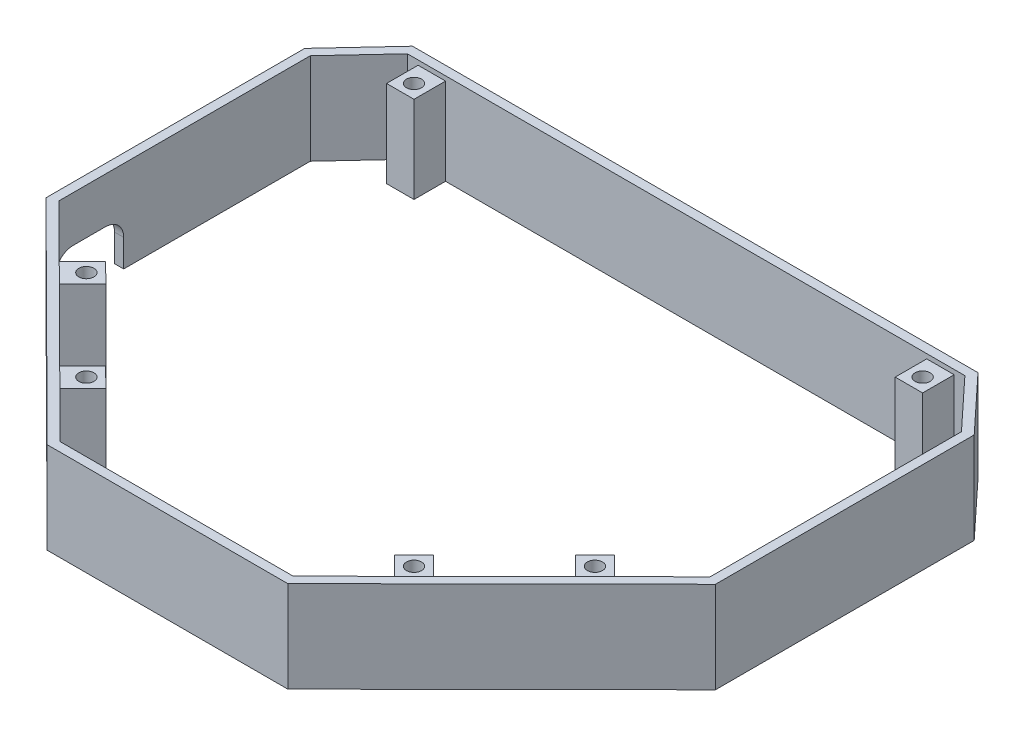
from build123d import *

# Parameters (mm, degrees)
BOSS_EXTRUDE1_DEPTH = 20
SKETCH2_R           = 1.65
SKETCH2_W           = 6
SKETCH2_H           = 6.9
BOSS_EXTRUDE2_DEPTH = 19
CUT_EXTRUDE1_DEPTH  = 10


with BuildPart() as part:
    # Sketch1 → Boss-Extrude1 (new body)
    with BuildSketch(Plane(origin=(0, 0, 0), x_dir=(1, 0, 0), z_dir=(0, 1, 0))):
        Polygon((-61.870068173, 40.5), (61.870068173, 40.5), (73.25, 28.287390235), (73.25, -28.33163873), (26.325219162, -75), (-26.325219162, -75), (-73.25, -28.33163873), (-73.25, 28.287390235), align=None)
        Polygon((-61, 38.5), (61, 38.5), (71.25, 27.5), (71.25, -27.5), (25.5, -73), (-25.5, -73), (-71.25, -27.5), (-71.25, 27.5), align=None, mode=Mode.SUBTRACT)
    extrude(amount=BOSS_EXTRUDE1_DEPTH)

    # Sketch2 → Boss-Extrude2 (add)
    # profile 1 of 6: a face of its own
    with BuildSketch(Plane(origin=(0, 0, 0), x_dir=(1, 0, 0), z_dir=(0, 1, 0))):
        Polygon((-40.880359301, -57.703686378), (-35.861623629, -52.657375236), (-31.607375236, -56.888376371), (-36.626110907, -61.934687513), align=None)
        with Locations(Location((-35.85, -56.9, 0), (0, 0, 270))):
            Circle(SKETCH2_R, mode=Mode.SUBTRACT)
    # profile 2 of 6: a face of its own
    with BuildSketch(Plane(origin=(0, 0, 0), x_dir=(1, 0, 0), z_dir=(0, 1, 0))):
        Polygon((-60.73445685, -37.958081166), (-55.661623629, -32.857375236), (-51.407375236, -37.088376371), (-56.480208456, -42.189082301), align=None)
        with Locations(Location((-55.65, -37.1, 0), (0, 0, 270))):
            Circle(SKETCH2_R, mode=Mode.SUBTRACT)
    # profile 3 of 6: a face of its own
    with BuildSketch(Plane(origin=(0, 0, 0), x_dir=(1, 0, 0), z_dir=(0, 1, 0))):
        with Locations((-55.65, 35.05)):
            Rectangle(SKETCH2_W, SKETCH2_H)
        with Locations(Location((-55.65, 34.6, 0), (0, 0, 270))):
            Circle(SKETCH2_R, mode=Mode.SUBTRACT)
    # profile 4 of 6: a face of its own
    with BuildSketch(Plane(origin=(0, 0, 0), x_dir=(1, 0, 0), z_dir=(0, 1, 0))):
        with Locations((55.65, 35.05)):
            Rectangle(SKETCH2_W, SKETCH2_H)
        with Locations(Location((55.65, 34.6, 0), (0, 0, 90))):
            Circle(SKETCH2_R, mode=Mode.SUBTRACT)
    # profile 5 of 6: a face of its own
    with BuildSketch(Plane(origin=(0, 0, 0), x_dir=(1, 0, 0), z_dir=(0, 1, 0))):
        Polygon((56.480208456, -42.189082301), (60.73445685, -37.958081166), (55.661623629, -32.857375236), (51.407375236, -37.088376371), align=None)
        with Locations(Location((55.65, -37.1, 0), (0, 0, 90))):
            Circle(SKETCH2_R, mode=Mode.SUBTRACT)
    # profile 6 of 6: a face of its own
    with BuildSketch(Plane(origin=(0, 0, 0), x_dir=(1, 0, 0), z_dir=(0, 1, 0))):
        Polygon((36.626110907, -61.934687513), (40.880359301, -57.703686378), (35.861623629, -52.657375236), (31.607375236, -56.888376371), align=None)
        with Locations(Location((35.85, -56.9, 0), (0, 0, 90))):
            Circle(SKETCH2_R, mode=Mode.SUBTRACT)
    extrude(amount=BOSS_EXTRUDE2_DEPTH)

    # Sketch3 → Cut-Extrude1 (cut)
    with BuildSketch(Plane.ZY.offset(73.25)):
        with BuildLine():
            Line((28.33163873, 0), (13.33163873, 0))
            Line((13.33163873, 0), (13.33163873, 6))
            ThreePointArc((13.33163873, 6), (14.503211605, 8.828427125), (17.33163873, 10))
            Line((17.33163873, 10), (24.33163873, 10))
            ThreePointArc((24.33163873, 10), (27.160065854, 8.828427125), (28.33163873, 6))
            Line((28.33163873, 6), (28.33163873, 0))
        make_face()
    extrude(amount=-CUT_EXTRUDE1_DEPTH, mode=Mode.SUBTRACT)


solid = part.part
